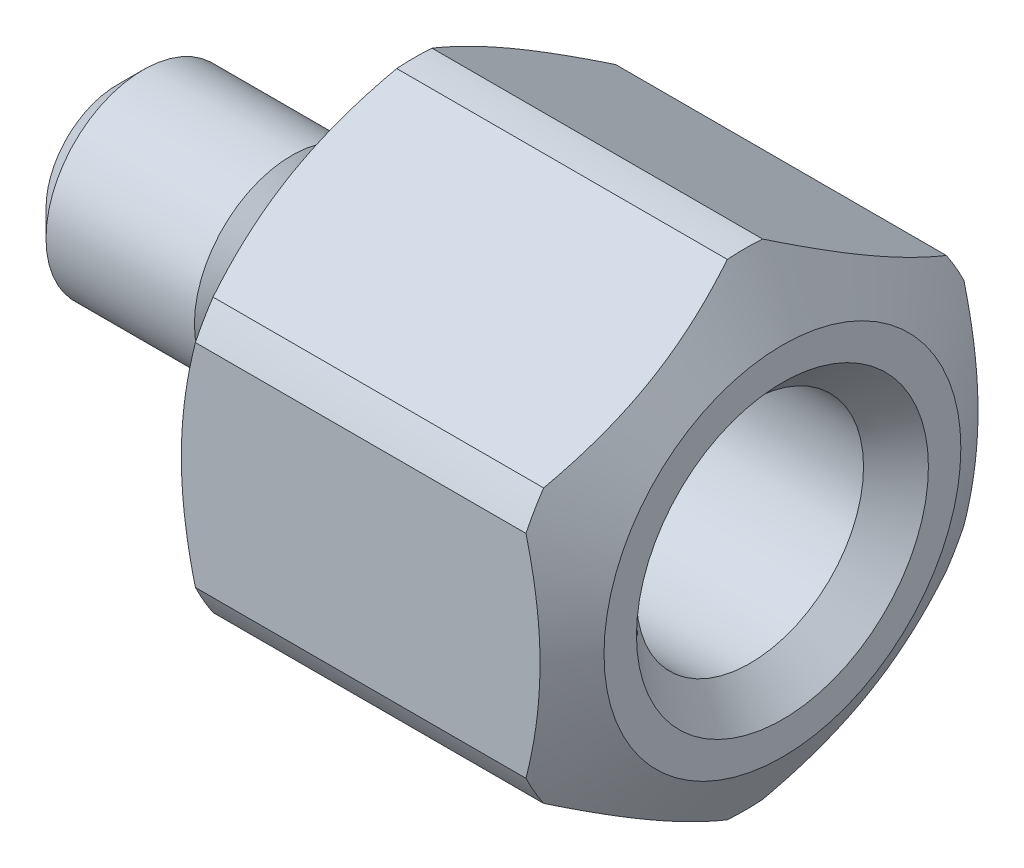
from build123d import *

# Parameters (mm, degrees)
SKETCH_2_OUTSIDE_W           = 43.8
SKETCH_2_OUTSIDE_H           = 43.8
CUT_EXTRUDE_1_DEPTH          = 47.16275555
HOLE_WIZARD_M161_D           = 14
HOLE_WIZARD_M161_DEPTH       = 20
HOLE_WIZARD_M161_CSINK_D     = 18
HOLE_WIZARD_M161_CSINK_ANGLE = 90


with BuildPart() as part:
    # Эскиз1 → Повернуть2 (revolve)
    with BuildSketch(Plane.XY, mode=Mode.PRIVATE) as revolve_2_sk:
        with BuildLine():
            Line((0, 2), (0, 4.4))
            Line((0, 4.4), (1.6, 6))
            Line((1.6, 6), (10.75, 6))
            Line((10.75, 6), (11.853553391, 4.896446609))
            ThreePointArc((11.853553391, 4.896446609), (12.015765065, 4.788060234), (12.207106781, 4.75))
            Line((12.207106781, 4.75), (15, 4.75))
            ThreePointArc((15, 4.75), (15.707106781, 5.042893219), (16, 5.75))
            Line((16, 5.75), (16, 11))
            Line((16, 11), (18.309401077, 15))
            Line((18.309401077, 15), (38.690598923, 15))
            Line((38.690598923, 15), (41, 11))
            Line((41, 11), (41, 0))
            Line((41, 0), (33.5, 0))
            Line((33.5, 0), (25.146446609, 8.353553391))
            ThreePointArc((25.146446609, 8.353553391), (24.984234935, 8.461939766), (24.792893219, 8.5))
            Line((24.792893219, 8.5), (22, 8.5))
            ThreePointArc((22, 8.5), (21.292893219, 8.207106781), (21, 7.5))
            Line((21, 7.5), (21, 4))
            Line((21, 4), (19, 2))
            Line((19, 2), (0, 2))
        make_face()
    revolve(revolve_2_sk.sketch.rotate(Axis((0, 0, 0), (1, 0, 0)), 90), axis=Axis((0, 0, 0), (1, 0, 0)))

    # Эскиз2 outside → Вырез-Вытянуть1 (cut, through all)
    with BuildSketch(Plane(origin=(41, 0, 0), x_dir=(0, 0, -1), z_dir=(1, 0, 0))):
        Rectangle(SKETCH_2_OUTSIDE_W, SKETCH_2_OUTSIDE_H)
        Polygon((0, 15.588457268), (-13.5, 7.794228634), (-13.5, -7.794228634), (0, -15.588457268), (13.5, -7.794228634), (13.5, 7.794228634), align=None, mode=Mode.SUBTRACT)
    extrude(amount=-CUT_EXTRUDE_1_DEPTH, mode=Mode.SUBTRACT)

    # Отверстие обработанное метчиком M161
    with Locations(Plane(origin=(41, 0, 0), x_dir=(0, 0, -1), z_dir=(1, 0, 0))):
        with Locations((0, 0)):
            CounterSinkHole(HOLE_WIZARD_M161_D / 2, HOLE_WIZARD_M161_CSINK_D / 2, depth=HOLE_WIZARD_M161_DEPTH, counter_sink_angle=HOLE_WIZARD_M161_CSINK_ANGLE)


solid = part.part
